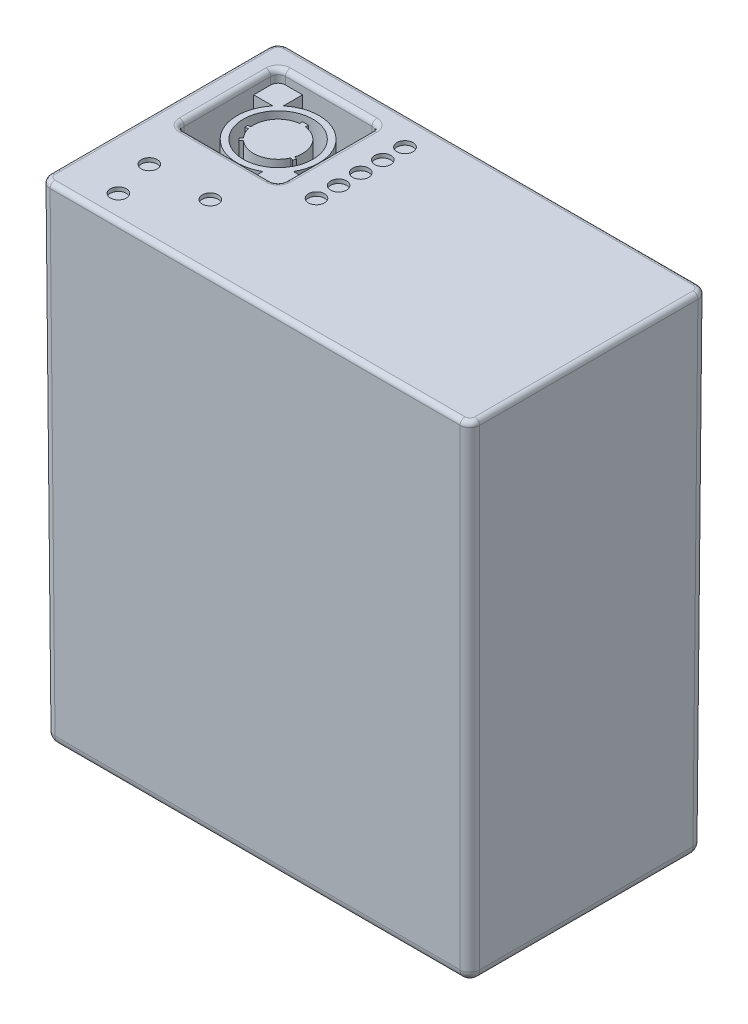
from build123d import *

# Parameters (mm, degrees)
SKETCH1_W          = 110.9726
SKETCH1_H          = 61.4426
EXTRUDE1_DEPTH     = 126.238
EXTRUDE1_DRAFT     = -0.3
CUT_EXTRUDE1_DEPTH = 3.175
CUT_EXTRUDE2_DEPTH = 12.7
SKETCH10_R         = 8.994906853
CUT_EXTRUDE3_DEPTH = 12.7
FILLET1_R          = 2.54
FILLET2_R          = 1.27
SKETCH2_R          = 2.0701
EXTRUDE2_DEPTH     = 1.016


with BuildPart() as part:
    # Sketch1 → Extrude1 (with draft: the straight prism first)
    with BuildSketch(Plane(origin=(0, 0, 0), x_dir=(1, 0, 0), z_dir=(0, 1, 0))):
        Rectangle(SKETCH1_W, SKETCH1_H)
    extrude(amount=-EXTRUDE1_DEPTH)
    # Extrude1: the draft: its side faces are tilted about the plane it starts from
    extrude1_sides = [part.faces().sort_by_distance(p)[0] for p in [
        (-55.4863, -63.119, 0),
        (0, -63.119, 30.7213),
        (55.4863, -63.119, 0),
        (0, -63.119, -30.7213),
    ]]
    draft(extrude1_sides, Plane(origin=(0, 0, 0), x_dir=(1, 0, 0), z_dir=(0, 1, 0)), EXTRUDE1_DRAFT)

    # Sketch9 → Cut-Extrude1 (cut)
    with BuildSketch(Plane(origin=(0, 0, 0), x_dir=(1, 0, 0), z_dir=(0, 1, 0))):
        with BuildLine():
            Line((-25.255419616, -1.4097), (-47.617180384, -1.4097))
            ThreePointArc((-47.617180384, -1.4097), (-48.960767849, -0.853167849), (-49.5173, 0.490419616))
            Line((-49.5173, 0.490419616), (-49.5173, 22.852180384))
            ThreePointArc((-49.5173, 22.852180384), (-48.960767849, 24.195767849), (-47.617180384, 24.7523))
            Line((-47.617180384, 24.7523), (-25.255419616, 24.7523))
            ThreePointArc((-25.255419616, 24.7523), (-23.911832151, 24.195767849), (-23.3553, 22.852180384))
            Line((-23.3553, 22.852180384), (-23.3553, 0.490419616))
            ThreePointArc((-23.3553, 0.490419616), (-23.911832151, -0.853167849), (-25.255419616, -1.4097))
        make_face()
    extrude(amount=-CUT_EXTRUDE1_DEPTH, mode=Mode.SUBTRACT)

    # Sketch9<3> → Cut-Extrude2 (cut)
    with BuildSketch(Plane(origin=(0, 0, 0), x_dir=(1, 0, 0), z_dir=(0, 1, 0))):
        with BuildLine():
            Line((-47.617180384, -1.4097), (-31.184011382, -1.4097))
            Line((-31.184011382, -1.4097), (-31.184011382, 2.484309248))
            ThreePointArc((-31.184011382, 2.484309248), (-44.547832783, 4.874950192), (-44.56182891, 18.450910219))
            Line((-44.56182891, 18.450910219), (-49.5173, 18.450910219))
            Line((-49.5173, 18.450910219), (-49.5173, 0.490419616))
            ThreePointArc((-49.5173, 0.490419616), (-48.960767849, -0.853167849), (-47.617180384, -1.4097))
        make_face()
        with BuildLine():
            Line((-27.249309248, 6.419011382), (-23.3553, 6.419011382))
            Line((-23.3553, 6.419011382), (-23.3553, 22.852180384))
            ThreePointArc((-23.3553, 22.852180384), (-23.911832151, 24.195767849), (-25.255419616, 24.7523))
            Line((-25.255419616, 24.7523), (-43.215910219, 24.7523))
            Line((-43.215910219, 24.7523), (-43.215910219, 19.79682891))
            ThreePointArc((-43.215910219, 19.79682891), (-29.639950192, 19.782832783), (-27.249309248, 6.419011382))
        make_face()
    extrude(amount=-CUT_EXTRUDE2_DEPTH, mode=Mode.SUBTRACT)

    # Sketch10 → Cut-Extrude3 (cut)
    with BuildSketch(Plane(origin=(0, -3.175, 0), x_dir=(1, 0, 0), z_dir=(0, 1, 0))):
        with Locations((-36.4363, 11.6713)):
            Circle(SKETCH10_R)
        with BuildLine():
            Line((-35.6743, 18.737414212), (-35.6743, 17.975414212))
            ThreePointArc((-35.6743, 17.975414212), (-31.684395119, 15.883413484), (-30.0863, 11.6713))
            ThreePointArc((-30.0863, 11.6713), (-30.152493141, 10.756821264), (-30.349692554, 9.861407793))
            Line((-30.349692554, 9.861407793), (-29.622896406, 9.596875629))
            Line((-29.622896406, 9.596875629), (-29.883515756, 8.880829852))
            Line((-29.883515756, 8.880829852), (-30.610311903, 9.145362016))
            ThreePointArc((-30.610311903, 9.145362016), (-35.061908451, 5.471820355), (-40.648930859, 6.919853773))
            Line((-40.648930859, 6.919853773), (-41.195835744, 6.372948889))
            Line((-41.195835744, 6.372948889), (-41.734651111, 6.911764256))
            Line((-41.734651111, 6.911764256), (-41.187746227, 7.458669141))
            ThreePointArc((-41.187746227, 7.458669141), (-42.068818791, 8.739196306), (-42.612402774, 10.195408906))
            Line((-42.612402774, 10.195408906), (-43.374092784, 10.061102407))
            Line((-43.374092784, 10.061102407), (-43.506412695, 10.811525914))
            Line((-43.506412695, 10.811525914), (-42.744722686, 10.945832414))
            ThreePointArc((-42.744722686, 10.945832414), (-41.421425305, 15.604622476), (-37.1983, 17.975414212))
            Line((-37.1983, 17.975414212), (-37.1983, 18.737414212))
            Line((-37.1983, 18.737414212), (-35.6743, 18.737414212))
        make_face(mode=Mode.SUBTRACT)
    extrude(amount=-CUT_EXTRUDE3_DEPTH, mode=Mode.SUBTRACT)

    # Fillet1
    fillet1_edges = [part.edges().sort_by_distance(p)[0] for p in [
        (0, -126.238, 30.060313337),
        (54.825313337, -126.238, 0),
        (0, -126.238, -30.060313337),
        (-54.825313337, -126.238, 0),
        (-55.155806669, -63.119, -30.390806669),
        (-55.155806669, -63.119, 30.390806669),
        (55.155806669, -63.119, -30.390806669),
        (55.155806669, -63.119, 30.390806669),
    ]]
    fillet(fillet1_edges, radius=FILLET1_R)

    # Fillet2
    fillet2_edges = [part.edges().sort_by_distance(p)[0] for p in [
        (54.742365646, 0, -29.977365646),
        (55.4863, 0, 0),
        (54.742365646, 0, 29.977365646),
        (0, 0, 30.7213),
        (-54.742365646, 0, 29.977365646),
        (-55.4863, 0, 0),
        (-54.742365646, 0, -29.977365646),
        (0, 0, -30.7213),
        (-36.4363, 0, -24.7523),
        (-48.960767849, 0, -24.195767849),
        (-49.5173, 0, -11.6713),
        (-48.960767849, 0, 0.853167849),
        (-36.4363, 0, 1.4097),
        (-23.911832151, 0, 0.853167849),
        (-23.3553, 0, -11.6713),
        (-23.911832151, 0, -24.195767849),
    ]]
    fillet(fillet2_edges, radius=FILLET2_R)

    # Sketch2 → Extrude2 (cut)
    with BuildSketch(Plane(origin=(0, 0, 0), x_dir=(1, 0, 0), z_dir=(0, 1, 0))):
        with Locations((-44.3103, -13.7287)):
            Circle(SKETCH2_R)
        with Locations((-28.5623, -13.7287)):
            Circle(SKETCH2_R)
        with Locations((-41.7703, -24.2443)):
            Circle(SKETCH2_R)
        with Locations((-15.1003, 23.1013)):
            Circle(SKETCH2_R)
        with Locations((-15.1003, 17.3863)):
            Circle(SKETCH2_R)
        with Locations((-15.1003, 11.6713)):
            Circle(SKETCH2_R)
        with Locations((-15.1003, 0.2413)):
            Circle(SKETCH2_R)
        with Locations((-15.1003, 5.9563)):
            Circle(SKETCH2_R)
    extrude(amount=-EXTRUDE2_DEPTH, mode=Mode.SUBTRACT)


solid = part.part
